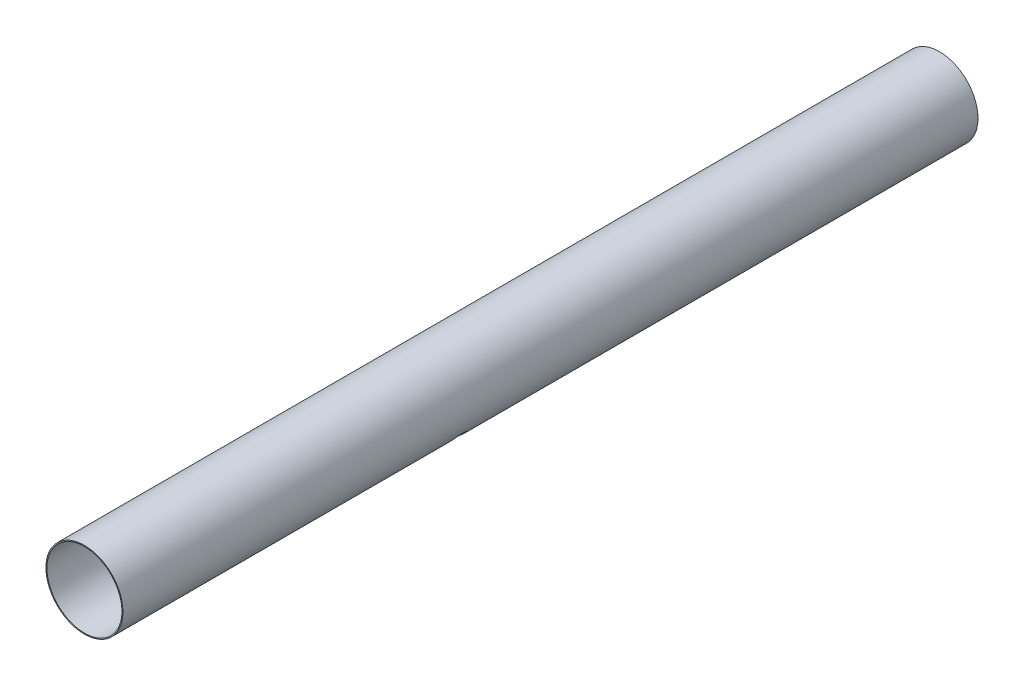
from build123d import *

# Parameters (mm, degrees)
SKETCH1_R           = 78.35
SKETCH1_R_2         = 76.35
BOSS_EXTRUDE1_DEPTH = 1740
SKETCH5_R           = 15
CUT_EXTRUDE2_DEPTH  = 1744.524432005


with BuildPart() as part:
    # Sketch1 → Boss-Extrude1 (new body)
    with BuildSketch(Plane.XY):
        with Locations(Location((0, 0, 0), (0, 0, 180))):
            Circle(SKETCH1_R)
        with Locations(Location((0, 0, 0), (0, 0, 180))):
            Circle(SKETCH1_R_2, mode=Mode.SUBTRACT)
    extrude(amount=BOSS_EXTRUDE1_DEPTH)

    # Sketch5 → Cut-Extrude2 (cut, through all)
    with BuildSketch(Plane(origin=(0, 0, 0), x_dir=(0, 0, -1), z_dir=(0.7071067811865489, -0.7071067811865462, 0))):
        with Locations(Location((-1034.89, 0, 0), (0, 0, 270))):
            Circle(SKETCH5_R)
    extrude(amount=CUT_EXTRUDE2_DEPTH, mode=Mode.SUBTRACT)


solid = part.part
